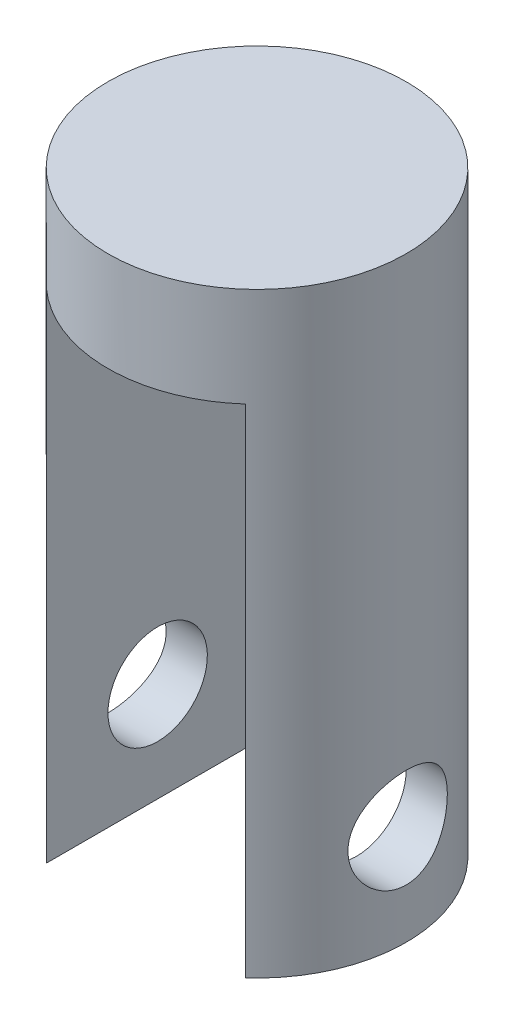
from build123d import *

# Parameters (mm, degrees)
SKIZZE1_R                            = 15
AUFSATZ_LINEAR_AUSTRAGEN1_DEPTH      = 10
AUFSATZ_LINEAR_START                 = -50
SKIZZE4_R                            = 15
AUFSATZ_LINEAR_AUSTRAGEN3_DEPTH      = 50
SCHNITT_LINEAR_AUSTRAGEN1_DEPTH      = 55.313902456
SCHNITT_LINEAR_AUSTRAGEN1_DEPTH_BACK = 55.313902456
SKIZZE5_W                            = 20
SKIZZE5_H                            = 50
SCHNITT_LINEAR_AUSTRAGEN2_DEPTH      = 55.313902456
SCHNITT_LINEAR_AUSTRAGEN2_DEPTH_BACK = 55.313902456
SKIZZE6_R                            = 5


with BuildPart() as part:
    # Skizze1 → Aufsatz-Linear austragen1 (new body)
    with BuildSketch(Plane(origin=(0, 0, 0), x_dir=(1, 0, 0), z_dir=(0, 1, 0))):
        with Locations(Location((0, 0, 0), (0, 0, 270))):
            Circle(SKIZZE1_R)
    extrude(amount=AUFSATZ_LINEAR_AUSTRAGEN1_DEPTH)

    # Skizze4 → Aufsatz-Linear austragen3 (add)
    with BuildSketch(Plane(origin=(0, 0, 0), x_dir=(1, 0, 0), z_dir=(0, 1, 0)).offset(AUFSATZ_LINEAR_START)):
        with Locations(Location((0, 0, 0), (0, 0, 270))):
            Circle(SKIZZE4_R)
    extrude(amount=AUFSATZ_LINEAR_AUSTRAGEN3_DEPTH)

    # Skizze5 → Schnitt-Linear austragen1 (cut, two sides: drawn at the far end of the back side and taken through both)
    with BuildSketch(Plane.XY.offset(-SCHNITT_LINEAR_AUSTRAGEN1_DEPTH_BACK)):
        with Locations((0, -25)):
            Rectangle(SKIZZE5_W, SKIZZE5_H)
    extrude(amount=SCHNITT_LINEAR_AUSTRAGEN1_DEPTH + SCHNITT_LINEAR_AUSTRAGEN1_DEPTH_BACK, mode=Mode.SUBTRACT)

    # Skizze6 → Schnitt-Linear austragen2 (cut, two sides: drawn at the far end of the back side and taken through both)
    with BuildSketch(Plane(origin=(0, 0, 0), x_dir=(0, 0, -1), z_dir=(1, 0, 0)).offset(-SCHNITT_LINEAR_AUSTRAGEN2_DEPTH_BACK)):
        with Locations((0, -40)):
            Circle(SKIZZE6_R)
    extrude(amount=SCHNITT_LINEAR_AUSTRAGEN2_DEPTH + SCHNITT_LINEAR_AUSTRAGEN2_DEPTH_BACK, mode=Mode.SUBTRACT)


solid = part.part
